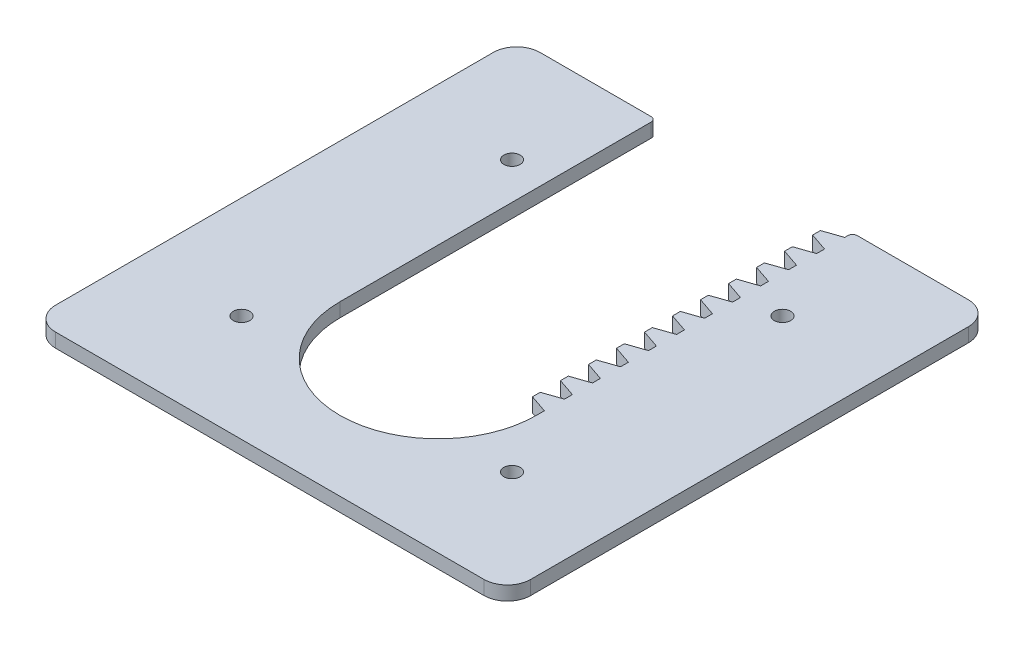
from build123d import *

# Parameters (mm, degrees)
SKETCH1_R           = 1.75
BOSS_EXTRUDE1_DEPTH = 3


with BuildPart() as part:
    # Sketch1 → Boss-Extrude1 (new body)
    with BuildSketch(Plane(origin=(0, 0, 0), x_dir=(1, 0, 0), z_dir=(0, 1, 0))):
        with BuildLine():
            Line((21.058452488, 3.842990858), (17.188733854, 5.16651258))
            Line((17.188733854, 5.16651258), (17.188733854, 6.83348742))
            Line((17.188733854, 6.83348742), (21.058452488, 8.157009142))
            Line((21.058452488, 8.157009142), (21.058452488, 9.842990858))
            Line((21.058452488, 9.842990858), (17.188733854, 11.16651258))
            Line((17.188733854, 11.16651258), (17.188733854, 12.83348742))
            Line((17.188733854, 12.83348742), (21.058452488, 14.157009142))
            Line((21.058452488, 14.157009142), (21.058452488, 15.842990858))
            Line((21.058452488, 15.842990858), (17.188733854, 17.16651258))
            Line((17.188733854, 17.16651258), (17.188733854, 18.83348742))
            Line((17.188733854, 18.83348742), (21.058452488, 20.157009142))
            Line((21.058452488, 20.157009142), (21.058452488, 21.842990858))
            Line((21.058452488, 21.842990858), (17.188733854, 23.16651258))
            Line((17.188733854, 23.16651258), (17.188733854, 24.83348742))
            Line((17.188733854, 24.83348742), (21.058452488, 26.157009142))
            Line((21.058452488, 26.157009142), (21.058452488, 27.842990858))
            Line((21.058452488, 27.842990858), (17.188733854, 29.16651258))
            Line((17.188733854, 29.16651258), (17.188733854, 30.83348742))
            Line((17.188733854, 30.83348742), (21.058452488, 32.157009142))
            Line((21.058452488, 32.157009142), (21.058452488, 33.842990858))
            Line((21.058452488, 33.842990858), (17.188733854, 35.16651258))
            Line((17.188733854, 35.16651258), (17.188733854, 36.83348742))
            Line((17.188733854, 36.83348742), (21.058452488, 38.157009142))
            Line((21.058452488, 38.157009142), (21.058452488, 39.842990858))
            Line((21.058452488, 39.842990858), (17.188733854, 41.16651258))
            Line((17.188733854, 41.16651258), (17.188733854, 42.83348742))
            Line((17.188733854, 42.83348742), (21.058452488, 44.157009142))
            Line((21.058452488, 44.157009142), (21.058452488, 45.842990858))
            Line((21.058452488, 45.842990858), (17.188733854, 47.16651258))
            Line((17.188733854, 47.16651258), (17.188733854, 48.83348742))
            Line((17.188733854, 48.83348742), (21.058452488, 50.157009142))
            Line((21.058452488, 50.157009142), (21.058452488, 51.842990858))
            Line((21.058452488, 51.842990858), (17.188733854, 53.16651258))
            Line((17.188733854, 53.16651258), (17.188733854, 54.83348742))
            Line((17.188733854, 54.83348742), (21.058452488, 56.157009142))
            Line((21.058452488, 56.157009142), (21.058452488, 57.842990858))
            Line((21.058452488, 57.842990858), (17.188733854, 59.16651258))
            Line((17.188733854, 59.16651258), (17.188733854, 60.83348742))
            Line((17.188733854, 60.83348742), (21.058452488, 62.157009142))
            Line((21.058452488, 62.157009142), (21.058452488, 62.842990858))
            ThreePointArc((21.058452488, 62.842990858), (21.351345707, 63.550097639), (22.058452488, 63.842990858))
            Line((22.058452488, 63.842990858), (45.872217102, 63.842990858))
            ThreePointArc((45.872217102, 63.842990858), (49.407751008, 62.378524764), (50.872217102, 58.842990858))
            Line((50.872217102, 58.842990858), (50.872217102, -34.901443346))
            ThreePointArc((50.872217102, -34.901443346), (49.407751008, -38.436977252), (45.872217102, -39.901443346))
            Line((45.872217102, -39.901443346), (-45.872217102, -39.901443346))
            ThreePointArc((-45.872217102, -39.901443346), (-49.407751008, -38.436977252), (-50.872217102, -34.901443346))
            Line((-50.872217102, -34.901443346), (-50.872217102, 58.842990858))
            ThreePointArc((-50.872217102, 58.842990858), (-49.407751008, 62.378524764), (-45.872217102, 63.842990858))
            Line((-45.872217102, 63.842990858), (-22.058452488, 63.842990858))
            ThreePointArc((-22.058452488, 63.842990858), (-21.351345707, 63.550097639), (-21.058452488, 62.842990858))
            Line((-21.058452488, 62.842990858), (-21.058452488, -3.842990858))
            ThreePointArc((-21.058452488, -3.842990858), (0, -24.901443346), (21.058452488, -3.842990858))
            Line((21.058452488, -3.842990858), (21.058452488, -2.157009142))
            Line((21.058452488, -2.157009142), (17.188733854, -0.83348742))
            Line((17.188733854, -0.83348742), (17.188733854, 0.83348742))
            Line((17.188733854, 0.83348742), (21.058452488, 2.157009142))
            Line((21.058452488, 2.157009142), (21.058452488, 3.842990858))
        make_face()
        with Locations(Location((28.965334795, -16.994561039, 0), (0, 0, 270))):
            Circle(SKETCH1_R, mode=Mode.SUBTRACT)
        with Locations(Location((-28.965334795, -16.994561039, 0), (0, 0, 270))):
            Circle(SKETCH1_R, mode=Mode.SUBTRACT)
        with Locations(Location((-28.965334795, 40.936108551, 0), (0, 0, 270))):
            Circle(SKETCH1_R, mode=Mode.SUBTRACT)
        with Locations(Location((28.965334795, 40.936108551, 0), (0, 0, 270))):
            Circle(SKETCH1_R, mode=Mode.SUBTRACT)
    extrude(amount=BOSS_EXTRUDE1_DEPTH)


solid = part.part
